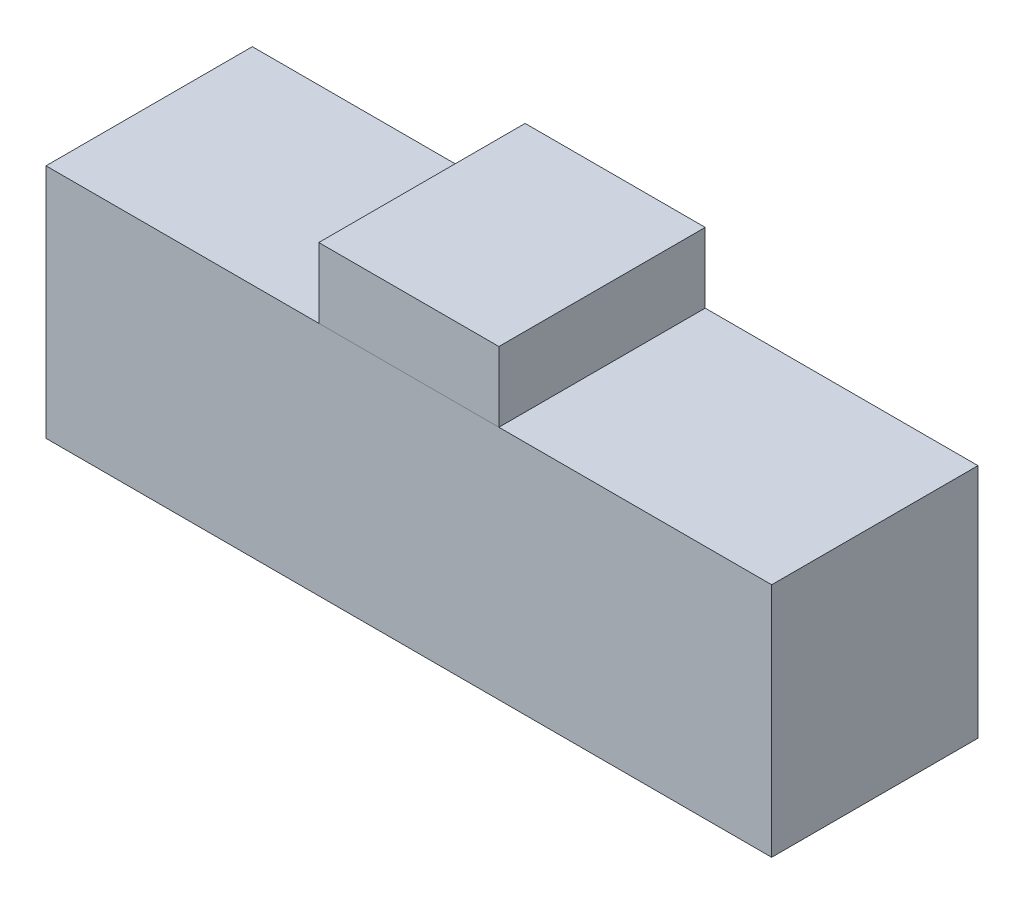
from build123d import *

# Parameters (mm, degrees)
SKETCH1_W           = 105.41
SKETCH1_H           = 34.29
BOSS_EXTRUDE1_DEPTH = 29.972
SKETCH2_W           = 26.162
SKETCH2_H           = 29.972
BOSS_EXTRUDE2_DEPTH = 10.16


with BuildPart() as part:
    # Sketch1 → Boss-Extrude1 (new body)
    with BuildSketch(Plane.XY):
        with Locations((52.705, 17.145)):
            Rectangle(SKETCH1_W, SKETCH1_H)
    extrude(amount=BOSS_EXTRUDE1_DEPTH)


with BuildPart() as body_2:
    # Sketch2 → Boss-Extrude2 (new body)
    with BuildSketch(Plane(origin=(0, 34.29, 0), x_dir=(1, 0, 0), z_dir=(0, 1, 0))):
        with Locations((52.705, -14.986)):
            Rectangle(SKETCH2_W, SKETCH2_H)
    extrude(amount=BOSS_EXTRUDE2_DEPTH)


solid = Compound([part.part, body_2.part])
